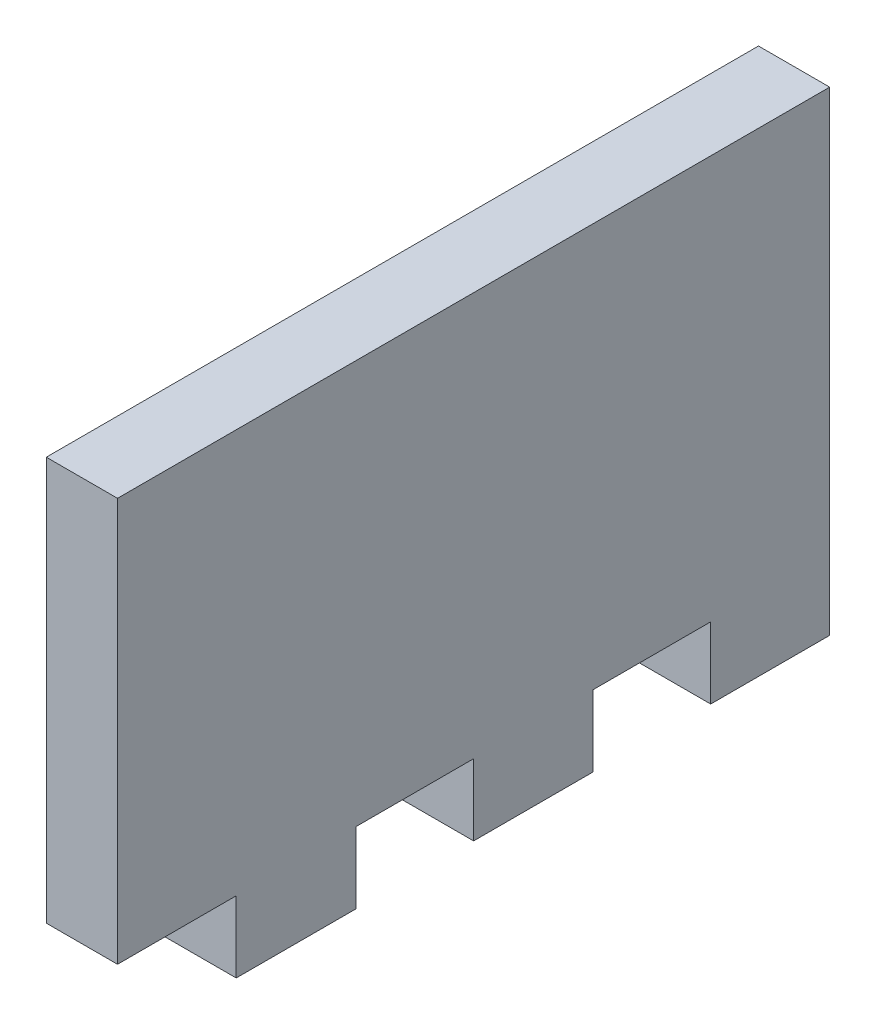
from build123d import *

# Parameters (mm, degrees)
SKETCH2_W           = 30
SKETCH2_H           = 20
BOSS_EXTRUDE2_DEPTH = 3
SKETCH4_W           = 5
SKETCH4_H           = 3
SKETCH4_W_2         = 4.96029665
SKETCH4_W_3         = 4.951588521
CUT_EXTRUDE1_DEPTH  = 3


with BuildPart() as part:
    # Sketch2 → Boss-Extrude2 (new body)
    with BuildSketch(Plane(origin=(0, 0, 0), x_dir=(0, 0, -1), z_dir=(1, 0, 0))):
        with Locations((15, 10)):
            Rectangle(SKETCH2_W, SKETCH2_H)
    extrude(amount=BOSS_EXTRUDE2_DEPTH)

    # Sketch4 → Cut-Extrude1 (cut)
    with BuildSketch(Plane(origin=(3, 0, 0), x_dir=(0, 0, -1), z_dir=(1, 0, 0))):
        with Locations((2.5, 1.5)):
            Rectangle(SKETCH4_W, SKETCH4_H)
        with Locations((12.519851675, 1.5)):
            Rectangle(SKETCH4_W_2, SKETCH4_H)
        with Locations((22.511261121, 1.5)):
            Rectangle(SKETCH4_W_3, SKETCH4_H)
    extrude(amount=-CUT_EXTRUDE1_DEPTH, mode=Mode.SUBTRACT)


solid = part.part
